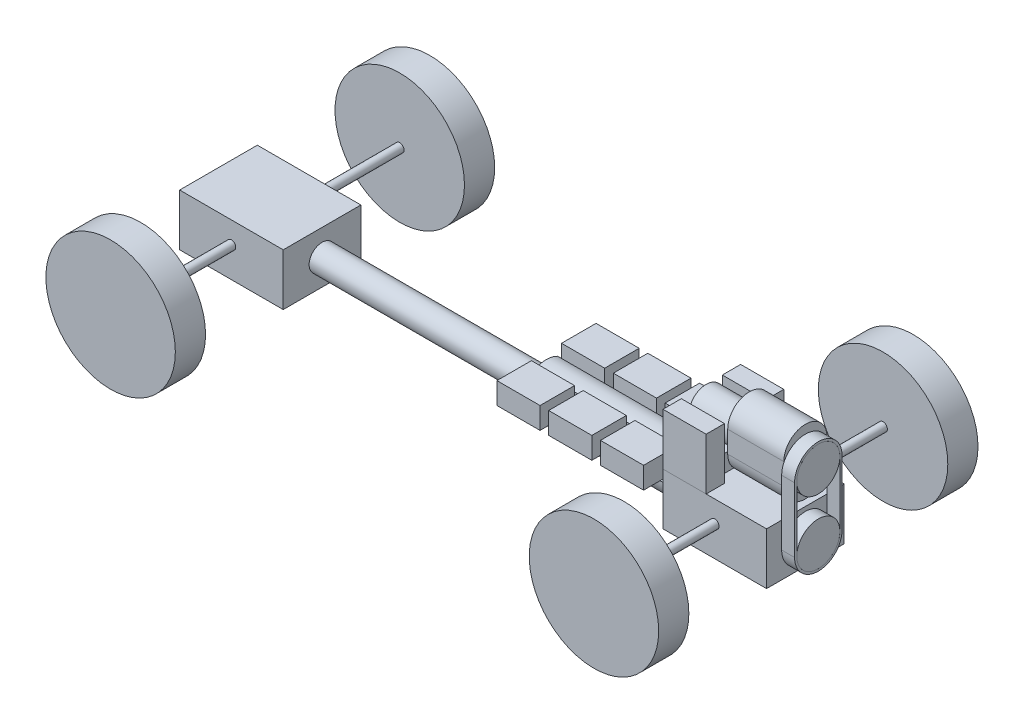
from build123d import *

# Parameters (mm, degrees)
SKETCH4_R              = 381
BOSS_EXTRUDE1_DEPTH    = 88.9
BOSS_EXTRUDE1_2_DEPTH  = 88.9
SKETCH3_R              = 381
BOSS_EXTRUDE2_DEPTH    = 88.9
BOSS_EXTRUDE2_2_DEPTH  = 88.9
BOSS_EXTRUDE3_START    = 203.2
SKETCH1_W              = 609.6
SKETCH1_H              = 457.2
BOSS_EXTRUDE3_DEPTH    = 304.8
BOSS_EXTRUDE3_2_DEPTH  = 304.8
SKETCH5_R              = 76.2
BOSS_EXTRUDE4_DEPTH    = 914.4
SKETCH5_3_R            = 76.2
BOSS_EXTRUDE5_DEPTH    = 2235.2
SKETCH6_R              = 127
BOSS_EXTRUDE6_DEPTH    = 76.2
BOSS_EXTRUDE6_2_DEPTH  = 76.2
BOSS_EXTRUDE8_DEPTH    = 330.2
SKETCH9_R              = 101.6
BOSS_EXTRUDE9_DEPTH    = 254
BOSS_EXTRUDE10_DEPTH   = 76.2
SKETCH11_W             = 254
SKETCH11_H             = 203.2
BOSS_EXTRUDE11_DEPTH   = 127
BOSS_EXTRUDE11_2_DEPTH = 127
BOSS_EXTRUDE11_3_DEPTH = 127
BOSS_EXTRUDE11_4_DEPTH = 127
BOSS_EXTRUDE11_5_DEPTH = 127
BOSS_EXTRUDE11_6_DEPTH = 127
BOSS_EXTRUDE12_DEPTH   = 304.8
BOSS_EXTRUDE12_2_DEPTH = 304.8
SKETCH12_3_W           = 177.8
SKETCH12_3_H           = 120.65
BOSS_EXTRUDE13_DEPTH   = 101.6
BOSS_EXTRUDE15_REACH   = 2649.242
SKETCH13_R             = 25.4


with BuildPart() as part:
    # Sketch4 → Boss-Extrude1 (new, symmetric)
    with BuildSketch(Plane.XY.offset(-850.9)):
        with Locations((1422.4, 381)):
            Circle(SKETCH4_R)
    extrude(amount=BOSS_EXTRUDE1_DEPTH, both=True)


with BuildPart() as body_2:
    # Sketch4 → Boss-Extrude1 2 (new, symmetric)
    with BuildSketch(Plane.XY.offset(-850.9)):
        with Locations((-1422.4, 381)):
            Circle(SKETCH4_R)
    extrude(amount=BOSS_EXTRUDE1_2_DEPTH, both=True)


with BuildPart() as body_3:
    # Sketch3 → Boss-Extrude2 (new, symmetric)
    with BuildSketch(Plane.XY.offset(850.9)):
        with Locations((1422.4, 381)):
            Circle(SKETCH3_R)
    extrude(amount=BOSS_EXTRUDE2_DEPTH, both=True)


with BuildPart() as body_4:
    # Sketch3 → Boss-Extrude2 2 (new, symmetric)
    with BuildSketch(Plane.XY.offset(850.9)):
        with Locations((-1422.4, 381)):
            Circle(SKETCH3_R)
    extrude(amount=BOSS_EXTRUDE2_2_DEPTH, both=True)

    # Boss-Extrude15: up to this face of the body (flat: up to its plane)
    boss_extrude15_end = Plane(body_4.part.faces().sort_by_distance((-1422.4, 381, 762))[0])
    # Sketch13 → Boss-Extrude15 (add, up to the picked face)
    with BuildSketch(Plane.XY.offset(-762), mode=Mode.PRIVATE) as boss_extrude15_sk1:
        with Locations(Location((-1422.4, 381, 0), (0, 0, 180))):
            Circle(SKETCH13_R)
    boss_extrude15_tool1 = split(extrude(boss_extrude15_sk1.sketch, amount=BOSS_EXTRUDE15_REACH, mode=Mode.PRIVATE), bisect_by=boss_extrude15_end, keep=Keep.BOTH, mode=Mode.PRIVATE)
    # Sketch13 → Boss-Extrude15 (add, up to the picked face)
    with BuildSketch(Plane.XY.offset(-762), mode=Mode.PRIVATE) as boss_extrude15_sk2:
        with Locations(Location((1422.4, 381, 0), (0, 0, 180))):
            Circle(SKETCH13_R)
    boss_extrude15_tool2 = split(extrude(boss_extrude15_sk2.sketch, amount=BOSS_EXTRUDE15_REACH, mode=Mode.PRIVATE), bisect_by=boss_extrude15_end, keep=Keep.BOTH, mode=Mode.PRIVATE)

    add(part.part)  # Boss-Extrude15 merges part

    add(body_2.part)  # Boss-Extrude15 merges body 2

    add(body_3.part)  # Boss-Extrude15 merges body 3


with BuildPart() as body_5:
    # Sketch1 → Boss-Extrude3 (new body)
    with BuildSketch(Plane(origin=(0, 0, 0), x_dir=(1, 0, 0), z_dir=(0, 1, 0)).offset(BOSS_EXTRUDE3_START)):
        with Locations((1422.4, 0)):
            Rectangle(SKETCH1_W, SKETCH1_H)
    extrude(amount=BOSS_EXTRUDE3_DEPTH)


with BuildPart() as body_6:
    # Sketch1 → Boss-Extrude3 2 (new body)
    with BuildSketch(Plane(origin=(0, 0, 0), x_dir=(1, 0, 0), z_dir=(0, 1, 0)).offset(BOSS_EXTRUDE3_START)):
        with Locations((-1422.4, 0)):
            Rectangle(SKETCH1_W, SKETCH1_H)
    extrude(amount=BOSS_EXTRUDE3_2_DEPTH)


with BuildPart() as body_7:
    # Sketch5 → Boss-Extrude4 (new body)
    with BuildSketch(Plane.ZY.offset(-1117.6)):
        with BuildLine():
            Line((-65.991135768, 478.731068378), (-65.991135768, 393.7))
            ThreePointArc((-65.991135768, 393.7), (0, 431.8), (65.991135768, 393.7))
            Line((65.991135768, 393.7), (65.991135768, 478.731068378))
            ThreePointArc((65.991135768, 478.731068378), (0, 495.3), (-65.991135768, 478.731068378))
        make_face()
        with BuildLine():
            Line((139.630201095, 351.184465811), (65.991135768, 393.7))
            ThreePointArc((65.991135768, 393.7), (73.603547963, 375.322011237), (76.2, 355.6))
            ThreePointArc((76.2, 355.6), (53.881536726, 301.718463274), (0, 279.4))
            Line((0, 279.4), (73.639065327, 236.884465811))
            ThreePointArc((73.639065327, 236.884465811), (120.983748909, 285.75), (139.630201095, 351.184465811))
        make_face()
        with BuildLine():
            ThreePointArc((0, 279.4), (-65.991135768, 317.5), (-65.991135768, 393.7))
            Line((-65.991135768, 393.7), (-139.630201095, 351.184465811))
            ThreePointArc((-139.630201095, 351.184465811), (-120.983748909, 285.75), (-73.639065327, 236.884465811))
            Line((-73.639065327, 236.884465811), (0, 279.4))
        make_face()
        with Locations((0, 355.6)):
            Circle(SKETCH5_R)
    extrude(amount=BOSS_EXTRUDE4_DEPTH)


with BuildPart() as body_8:
    # Sketch5<3> → Boss-Extrude5 (new body)
    with BuildSketch(Plane.ZY.offset(-1117.6)):
        with Locations((0, 355.6)):
            Circle(SKETCH5_3_R)
    extrude(amount=BOSS_EXTRUDE5_DEPTH)


with BuildPart() as body_9:
    # Sketch6 → Boss-Extrude6 (new body)
    with BuildSketch(Plane(origin=(1727.2, 0, 0), x_dir=(0, 0, -1), z_dir=(1, 0, 0))):
        with Locations(Location((0, 355.6, 0), (0, 0, 180))):
            Circle(SKETCH6_R)
    extrude(amount=BOSS_EXTRUDE6_DEPTH)


with BuildPart() as body_10:
    # Sketch6 → Boss-Extrude6 2 (new body)
    with BuildSketch(Plane(origin=(1727.2, 0, 0), x_dir=(0, 0, -1), z_dir=(1, 0, 0))):
        with Locations(Location((0, 736.6, 0), (0, 0, 180))):
            Circle(SKETCH6_R)
    extrude(amount=BOSS_EXTRUDE6_2_DEPTH)


with BuildPart() as body_11:
    # Sketch8 → Boss-Extrude8 (new body)
    with BuildSketch(Plane.ZY.offset(-1727.2)):
        with BuildLine():
            Line((-127, 673.1), (-127, 800.1))
            ThreePointArc((-127, 800.1), (0, 927.1), (127, 800.1))
            Line((127, 800.1), (127, 673.1))
            ThreePointArc((127, 673.1), (0, 546.1), (-127, 673.1))
        make_face()
    extrude(amount=BOSS_EXTRUDE8_DEPTH)


with BuildPart() as body_12:
    # Sketch9 → Boss-Extrude9 (new body)
    with BuildSketch(Plane.ZY.offset(-1397)):
        with Locations((0, 736.6)):
            Circle(SKETCH9_R)
    extrude(amount=BOSS_EXTRUDE9_DEPTH)


with BuildPart() as body_13:
    # Sketch6<3> → Boss-Extrude10 (new body)
    with BuildSketch(Plane(origin=(1727.2, 0, 0), x_dir=(0, 0, -1), z_dir=(1, 0, 0))):
        with BuildLine():
            Line((139.7, 736.6), (139.7, 355.6))
            ThreePointArc((139.7, 355.6), (0, 215.9), (-139.7, 355.6))
            Line((-139.7, 355.6), (-139.7, 736.6))
            ThreePointArc((-139.7, 736.6), (0, 876.3), (139.7, 736.6))
        make_face()
        with BuildLine():
            Line((-127, 355.6), (-127, 736.6))
            ThreePointArc((-127, 736.6), (0, 863.6), (127, 736.6))
            Line((127, 736.6), (127, 355.6))
            ThreePointArc((127, 355.6), (0, 228.6), (-127, 355.6))
        make_face(mode=Mode.SUBTRACT)
    extrude(amount=BOSS_EXTRUDE10_DEPTH)


with BuildPart() as body_14:
    # Sketch11 → Boss-Extrude11 (new body)
    with BuildSketch(Plane(origin=(0, 406.4, 0), x_dir=(1, 0, 0), z_dir=(0, 1, 0))):
        with Locations((635, -190.260072631)):
            Rectangle(SKETCH11_W, SKETCH11_H)
    extrude(amount=BOSS_EXTRUDE11_DEPTH)


with BuildPart() as body_15:
    # Sketch11 → Boss-Extrude11 2 (new body)
    with BuildSketch(Plane(origin=(0, 406.4, 0), x_dir=(1, 0, 0), z_dir=(0, 1, 0))):
        with Locations((330.2, -190.260072631)):
            Rectangle(SKETCH11_W, SKETCH11_H)
    extrude(amount=BOSS_EXTRUDE11_2_DEPTH)


with BuildPart() as body_16:
    # Sketch11 → Boss-Extrude11 3 (new body)
    with BuildSketch(Plane(origin=(0, 406.4, 0), x_dir=(1, 0, 0), z_dir=(0, 1, 0))):
        with Locations((939.8, -190.260072631)):
            Rectangle(SKETCH11_W, SKETCH11_H)
    extrude(amount=BOSS_EXTRUDE11_3_DEPTH)


with BuildPart() as body_17:
    # Sketch11 → Boss-Extrude11 4 (new body)
    with BuildSketch(Plane(origin=(0, 406.4, 0), x_dir=(1, 0, 0), z_dir=(0, 1, 0))):
        with Locations((939.8, 190.260072631)):
            Rectangle(SKETCH11_W, SKETCH11_H)
    extrude(amount=BOSS_EXTRUDE11_4_DEPTH)


with BuildPart() as body_18:
    # Sketch11 → Boss-Extrude11 5 (new body)
    with BuildSketch(Plane(origin=(0, 406.4, 0), x_dir=(1, 0, 0), z_dir=(0, 1, 0))):
        with Locations((635, 190.260072631)):
            Rectangle(SKETCH11_W, SKETCH11_H)
    extrude(amount=BOSS_EXTRUDE11_5_DEPTH)


with BuildPart() as body_19:
    # Sketch11 → Boss-Extrude11 6 (new body)
    with BuildSketch(Plane(origin=(0, 406.4, 0), x_dir=(1, 0, 0), z_dir=(0, 1, 0))):
        with Locations((330.2, 190.260072631)):
            Rectangle(SKETCH11_W, SKETCH11_H)
    extrude(amount=BOSS_EXTRUDE11_6_DEPTH)


with BuildPart() as body_20:
    # Sketch12 → Boss-Extrude12 (new body)
    with BuildSketch(Plane(origin=(0, 508, 0), x_dir=(1, 0, 0), z_dir=(0, 1, 0))):
        Polygon((1371.6, 228.6), (1117.6, 228.6), (1117.6, 120.65), (1143, 120.65), (1320.8, 120.65), (1371.6, 120.65), align=None)
    extrude(amount=BOSS_EXTRUDE12_DEPTH)



with BuildPart() as body_21:
    # Sketch12 → Boss-Extrude12 2 (new body)
    with BuildSketch(Plane(origin=(0, 508, 0), x_dir=(1, 0, 0), z_dir=(0, 1, 0))):
        Polygon((1143, -120.65), (1117.6, -120.65), (1117.6, -228.6), (1371.6, -228.6), (1371.6, -120.65), (1320.8, -120.65), align=None)
    extrude(amount=BOSS_EXTRUDE12_2_DEPTH)


with BuildPart() as body_20_1:
    add(body_20.part)

    add(body_21.part)  # Boss-Extrude13 merges body 21
    # Sketch12<3> → Boss-Extrude13 (add)
    with BuildSketch(Plane(origin=(0, 508, 0), x_dir=(1, 0, 0), z_dir=(0, 1, 0))):
        with Locations((1231.9, -60.325)):
            Rectangle(SKETCH12_3_W, SKETCH12_3_H)
        with Locations((1231.9, 60.325)):
            Rectangle(SKETCH12_3_W, SKETCH12_3_H)
    extrude(amount=BOSS_EXTRUDE13_DEPTH)


with BuildPart() as body_4_1:
    add(body_4.part)

    add(body_5.part)  # Boss-Extrude15 merges body 5

    add(body_6.part)  # Boss-Extrude15 merges body 6
    add(boss_extrude15_tool1.solids().sort_by(Axis((-1422.4, 381, -762), (0, 0, 1)))[0])
    add(boss_extrude15_tool2.solids().sort_by(Axis((1422.4, 381, -762), (0, 0, 1)))[0])


solid = Compound([body_7.part, body_8.part, body_9.part, body_10.part, body_11.part, body_12.part, body_13.part, body_14.part, body_15.part, body_16.part, body_17.part, body_18.part, body_19.part, body_20_1.part, body_4_1.part])
